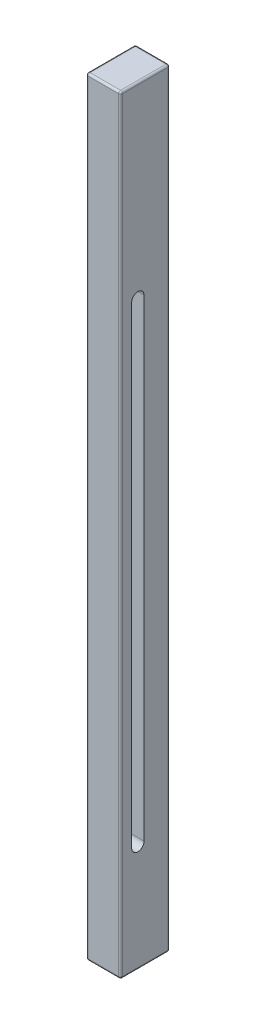
from build123d import *

# Parameters (mm, degrees)
SKETCH1_W           = 44.45
SKETCH1_H           = 63.5
BOSS_EXTRUDE1_DEPTH = 990.6
FILLET1_R           = 2.54
CUT_EXTRUDE1_DEPTH  = 23.495
FILLET2_R           = 2.54
SKETCH3_R           = 9.525
CUT_EXTRUDE2_DEPTH  = 25.4
CUT_EXTRUDE3_DEPTH  = 25.4


with BuildPart() as part:
    # Sketch1 → Boss-Extrude1 (new body)
    with BuildSketch(Plane(origin=(0, 0, 0), x_dir=(1, 0, 0), z_dir=(0, 1, 0))):
        Rectangle(SKETCH1_W, SKETCH1_H)
    extrude(amount=BOSS_EXTRUDE1_DEPTH)

    # Fillet1
    fillet1_edges = [part.edges().sort_by_distance(p)[0] for p in [
        (-22.225, 495.3, -31.75),
        (22.225, 495.3, -31.75),
        (22.225, 495.3, 31.75),
        (-22.225, 495.3, 31.75),
    ]]
    fillet(fillet1_edges, radius=FILLET1_R)

    # Sketch2 → Cut-Extrude1 (cut)
    with BuildSketch(Plane(origin=(22.225, 0, 0), x_dir=(0, 0, -1), z_dir=(1, 0, 0))):
        with BuildLine():
            Line((-1.5875, 749.3), (-1.5875, 139.7))
            ThreePointArc((-1.5875, 139.7), (-9.525, 131.7625), (-17.4625, 139.7))
            Line((-17.4625, 139.7), (-17.4625, 749.3))
            ThreePointArc((-17.4625, 749.3), (-9.525, 757.2375), (-1.5875, 749.3))
        make_face()
    extrude(amount=-CUT_EXTRUDE1_DEPTH, mode=Mode.SUBTRACT)

    # Fillet2
    fillet2_edges = [part.edges().sort_by_distance(p)[0] for p in [
        (-22.225, 0, 0),
        (-22.225, 990.6, 0),
        (0, 0, -31.75),
        (22.225, 0, 0),
        (0, 0, 31.75),
        (21.481051224, 0, 31.006051224),
        (21.481051224, 0, -31.006051224),
        (-21.481051224, 0, 31.006051224),
        (-21.481051224, 0, -31.006051224),
        (0, 990.6, -31.75),
        (0, 990.6, 31.75),
        (22.225, 990.6, 0),
        (21.481051224, 990.6, 31.006051224),
        (21.481051224, 990.6, -31.006051224),
        (-21.481051224, 990.6, 31.006051224),
        (-21.481051224, 990.6, -31.006051224),
    ]]
    fillet(fillet2_edges, radius=FILLET2_R)

    # Sketch3 → Cut-Extrude2 (cut)
    with BuildSketch(Plane.XZ):
        with Locations(Location((0, 0, 0), (0, 0, 270))):
            Circle(SKETCH3_R)
    extrude(amount=-CUT_EXTRUDE2_DEPTH, mode=Mode.SUBTRACT)

    # Sketch4 → Cut-Extrude3 (cut)
    with BuildSketch(Plane(origin=(0, 0, -31.75), x_dir=(-1, 0, 0), z_dir=(0, 0, -1))):
        with BuildLine():
            Line((6.35, 914.4), (6.35, 863.6))
            ThreePointArc((6.35, 863.6), (0, 857.25), (-6.35, 863.6))
            Line((-6.35, 863.6), (-6.35, 914.4))
            ThreePointArc((-6.35, 914.4), (0, 920.75), (6.35, 914.4))
        make_face()
        with BuildLine():
            Line((6.35, 666.75), (6.35, 615.95))
            ThreePointArc((6.35, 615.95), (0, 609.6), (-6.35, 615.95))
            Line((-6.35, 615.95), (-6.35, 666.75))
            ThreePointArc((-6.35, 666.75), (0, 673.1), (6.35, 666.75))
        make_face()
        with BuildLine():
            Line((6.35, 342.9), (6.35, 292.1))
            ThreePointArc((6.35, 292.1), (0, 285.75), (-6.35, 292.1))
            Line((-6.35, 292.1), (-6.35, 342.9))
            ThreePointArc((-6.35, 342.9), (0, 349.25), (6.35, 342.9))
        make_face()
    extrude(amount=-CUT_EXTRUDE3_DEPTH, mode=Mode.SUBTRACT)


solid = part.part
